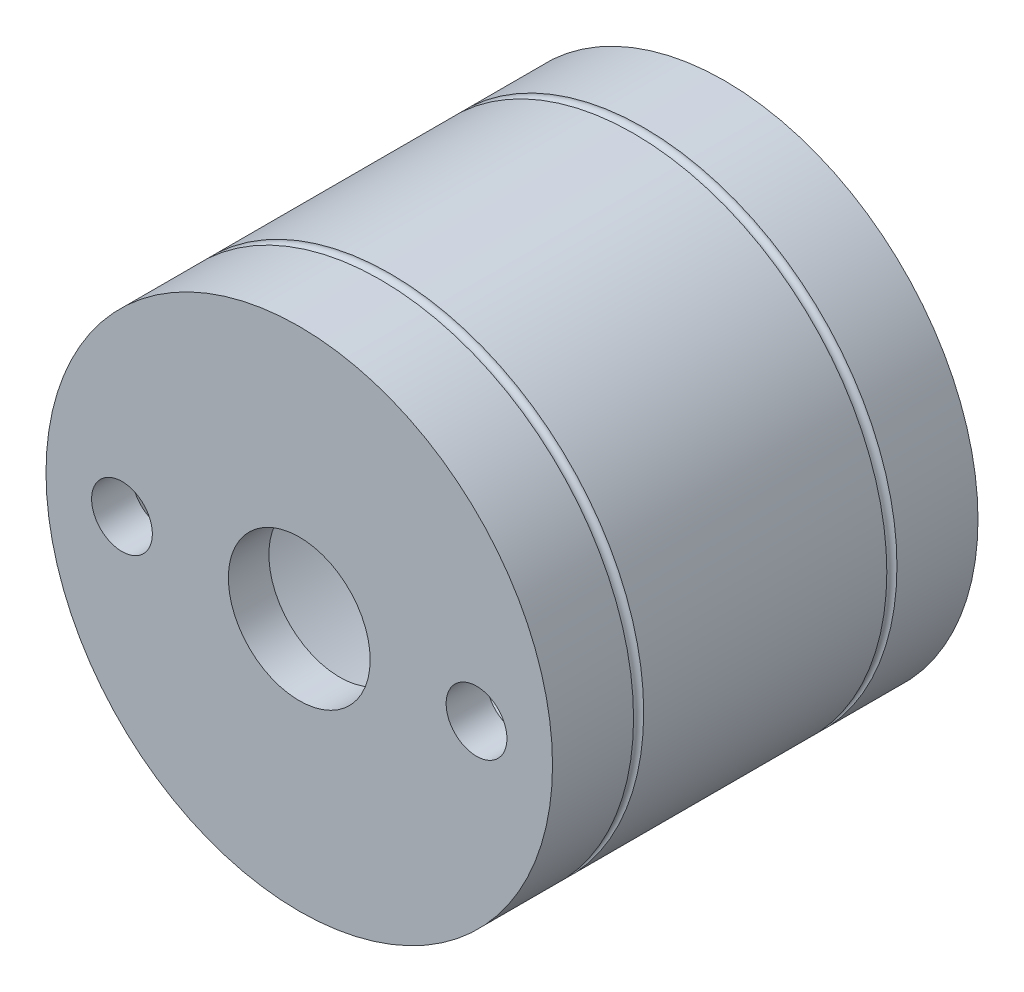
from build123d import *

# Parameters (mm, degrees)
SKETCH1_R           = 12.5
BOSS_EXTRUDE1_DEPTH = 21
SHELL1_T            = -2
SKETCH3_R           = 3.5
CUT_EXTRUDE1_DEPTH  = 28.449954463
SKETCH4_R           = 1.5
CUT_EXTRUDE2_DEPTH  = 28.449954463
SKETCH9_R           = 0.25
SKETCH8_R           = 0.25


with BuildPart() as part:
    # Sketch1 → Boss-Extrude1 (new body)
    with BuildSketch(Plane.XY):
        with Locations(Location((0, 0, 0), (0, 0, 180))):
            Circle(SKETCH1_R)
    extrude(amount=BOSS_EXTRUDE1_DEPTH)

    # Shell1
    shell1_openings = [part.faces().sort_by_distance(p)[0] for p in [
        (0, 0, 0),
    ]]
    offset(amount=SHELL1_T, openings=shell1_openings, kind=Kind.INTERSECTION)

    # Sketch3 → Cut-Extrude1 (cut, through all)
    with BuildSketch(Plane.XY.offset(21)):
        Circle(SKETCH3_R)
    extrude(amount=-CUT_EXTRUDE1_DEPTH, mode=Mode.SUBTRACT)

    # Sketch4 → Cut-Extrude2 (cut, through all)
    with BuildSketch(Plane.XY.offset(21)):
        with Locations((8.75, 0)):
            Circle(SKETCH4_R)
        with Locations((-8.75, 0)):
            Circle(SKETCH4_R)
    extrude(amount=-CUT_EXTRUDE2_DEPTH, mode=Mode.SUBTRACT)

    # Cut-Sweep1: sweep along a path in Sketch6
    with BuildLine(Plane.XY.offset(16.75)) as cut_sweep1_path:
        CenterArc((0, 0), 12.5, 0, 360)
    # Sketch9 → Cut-Sweep1 (sweep, cut)
    with BuildSketch(Plane(origin=(0, 0, 0), x_dir=(0, 0, -1), z_dir=(1, 0, 0))):
        with Locations((-16.75, 12.5)):
            Circle(SKETCH9_R)
    sweep(path=cut_sweep1_path.line, mode=Mode.SUBTRACT)

    # Cut-Sweep2: sweep along a path in Sketch7
    with BuildLine(Plane(origin=(0, 0, 4.25), x_dir=(-1, 0, 0), z_dir=(0, 0, -1))) as cut_sweep2_path:
        CenterArc((0, 0), 12.5, 0, 360)
    # Sketch8 → Cut-Sweep2 (sweep, cut)
    with BuildSketch(Plane(origin=(0, 0, 0), x_dir=(0, 0, -1), z_dir=(1, 0, 0))):
        with Locations((-4.25, 12.5)):
            Circle(SKETCH8_R)
    sweep(path=cut_sweep2_path.line, mode=Mode.SUBTRACT)


solid = part.part
